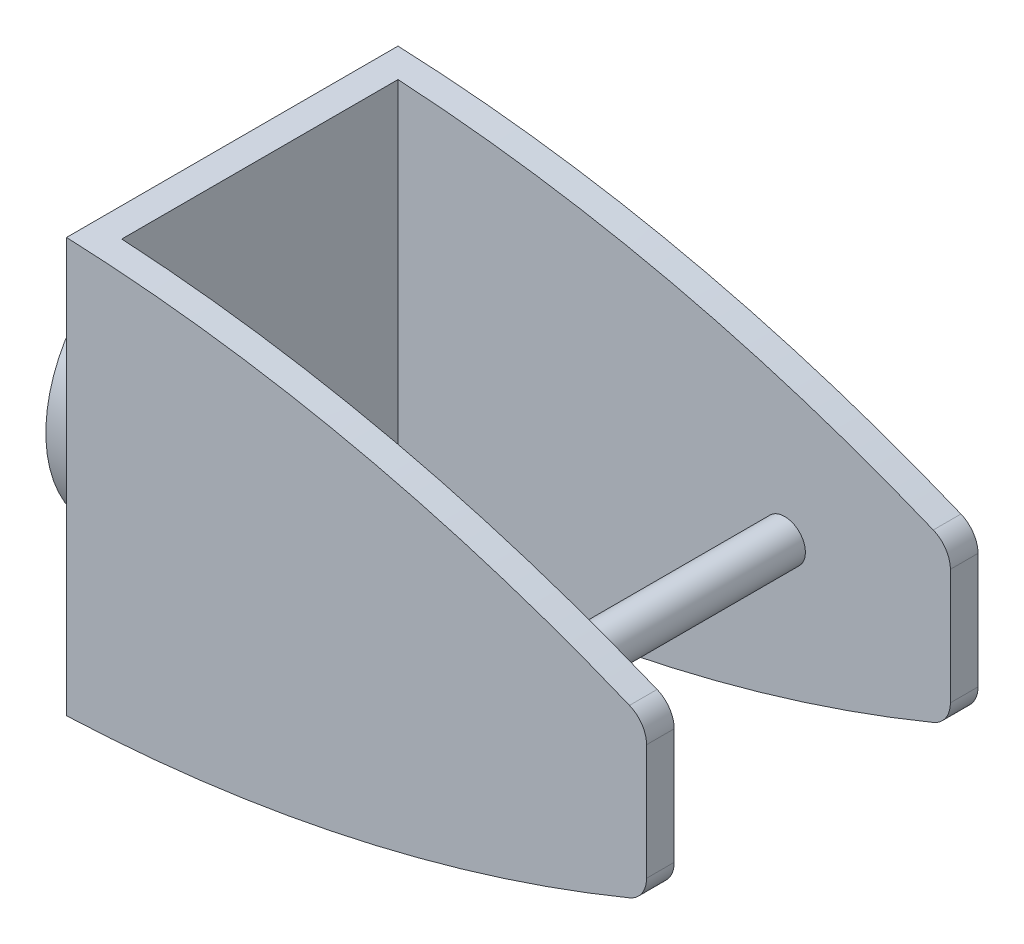
from build123d import *

# Parameters (mm, degrees)
SKETCH_1_R          = 10
EXTRUDE_1_DEPTH     = 3.5
SKETCH_2_W          = 24
SKETCH_2_H          = 30
EXTRUDE_2_DEPTH     = 2
SKETCH_3_W          = 2
SKETCH_3_H          = 30
EXTRUDE_3_DEPTH     = 40
CUT_EXTRUDE_1_DEPTH = 40
FILLET_1_R          = 2
SKETCH_5_R          = 1.5
EXTRUDE_4_DEPTH     = 24


with BuildPart() as part:
    # 草图1 → 凸台-拉伸1 (new body)
    with BuildSketch(Plane(origin=(0, 0, 0), x_dir=(0, 0, -1), z_dir=(1, 0, 0))):
        Circle(SKETCH_1_R)
    extrude(amount=EXTRUDE_1_DEPTH)

    # 草图2 → 凸台-拉伸2 (add)
    with BuildSketch(Plane(origin=(3.5, 0, 0), x_dir=(0, 0, -1), z_dir=(1, 0, 0))):
        Rectangle(SKETCH_2_W, SKETCH_2_H)
    extrude(amount=EXTRUDE_2_DEPTH)

    # 草图3 → 凸台-拉伸3 (add)
    with BuildSketch(Plane(origin=(5.5, 0, 0), x_dir=(0, 0, -1), z_dir=(1, 0, 0))):
        with Locations((11, 0)):
            Rectangle(SKETCH_3_W, SKETCH_3_H)
        with Locations((-11, 0)):
            Rectangle(SKETCH_3_W, SKETCH_3_H)
    extrude(amount=EXTRUDE_3_DEPTH)

    # 草图4 → 切除-拉伸1 (cut)
    with BuildSketch(Plane.XY.offset(12)):
        with BuildLine():
            Line((45.5, 5.517073487), (45.5, 15))
            Line((45.5, 15), (3.5, 15))
            ThreePointArc((3.5, 15), (24.928800083, 12.157697667), (45.5, 5.517073487))
        make_face()
        with BuildLine():
            Line((3.5, -15), (45.5, -15))
            Line((45.5, -15), (45.5, -5.517073487))
            ThreePointArc((45.5, -5.517073487), (24.928800083, -12.157697667), (3.5, -15))
        make_face()
    extrude(amount=-CUT_EXTRUDE_1_DEPTH, mode=Mode.SUBTRACT)

    # 圆角1
    fillet_1_edges = [part.edges().sort_by_distance(p)[0] for p in [
        (45.5, -5.517073487, 11),
        (45.5, 5.517073487, 11),
        (45.5, 5.517073487, -11),
        (45.5, -5.517073487, -11),
    ]]
    fillet(fillet_1_edges, radius=FILLET_1_R)

    # 草图5 → 凸台-拉伸4 (add)
    with BuildSketch(Plane.XY.offset(12)):
        with Locations(Location((33.5, 0, 0), (0, 0, 270))):
            Circle(SKETCH_5_R)
    extrude(amount=-EXTRUDE_4_DEPTH)


solid = part.part
